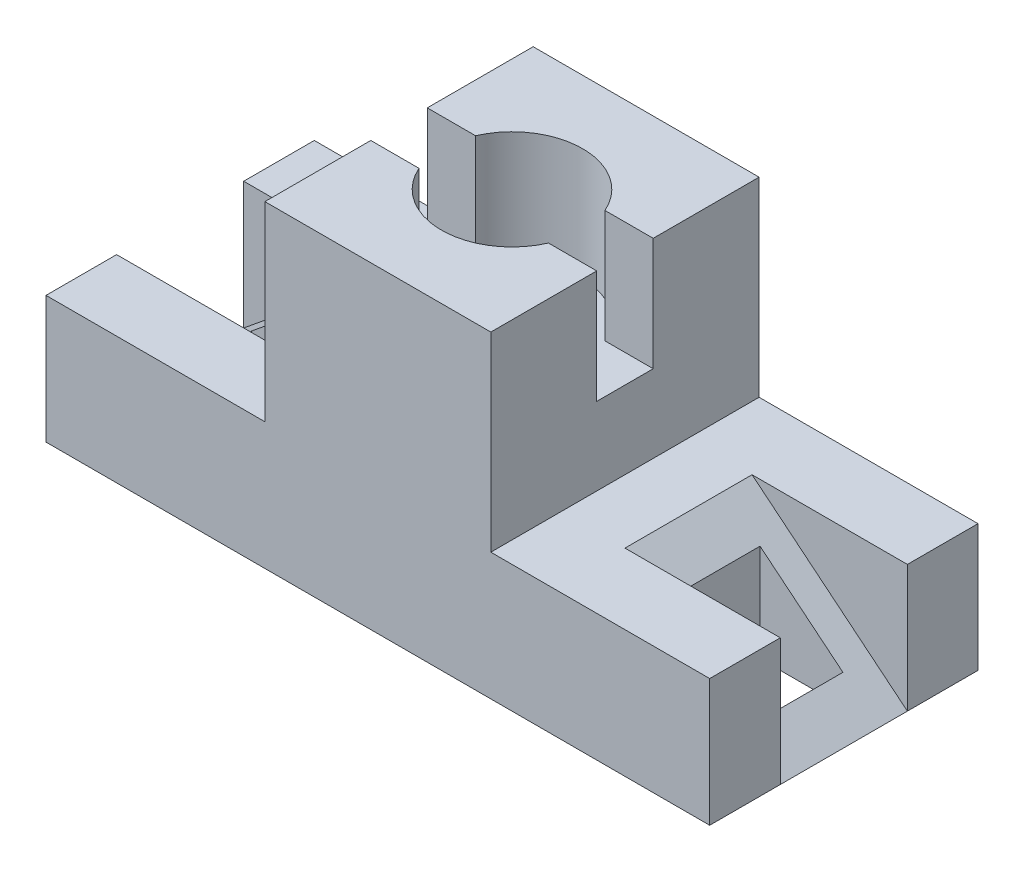
from build123d import *

# Parameters (mm, degrees)
BOSS_EXTRUDE1_DEPTH = 38
CUT_EXTRUDE1_DEPTH  = 16
SKETCH4_W           = 28.425340807
SKETCH4_H           = 18
CUT_EXTRUDE2_DEPTH  = 46
SKETCH5_W           = 11.74
SKETCH5_H           = 10
CUT_EXTRUDE3_DEPTH  = 76


with BuildPart() as part:
    # Sketch1 → Boss-Extrude1 (new body)
    with BuildSketch(Plane.XY):
        Polygon((0, 0), (0, 18), (31, 18), (31, 45), (63, 45), (63, 18), (94, 18), (94, 0), align=None)
    extrude(amount=BOSS_EXTRUDE1_DEPTH)

    # Sketch2 → Cut-Extrude1 (cut)
    with BuildSketch(Plane(origin=(0, 45, 0), x_dir=(1, 0, 0), z_dir=(0, 1, 0))):
        with BuildLine():
            Line((63, -23), (63, -15))
            Line((63, -15), (56.16515139, -15))
            ThreePointArc((56.16515139, -15), (47, -9), (37.83484861, -15))
            Line((37.83484861, -15), (31, -15))
            Line((31, -15), (31, -23))
            Line((31, -23), (37.83484861, -23))
            ThreePointArc((37.83484861, -23), (47, -29), (56.16515139, -23))
            Line((56.16515139, -23), (63, -23))
        make_face()
    extrude(amount=-CUT_EXTRUDE1_DEPTH, mode=Mode.SUBTRACT)

    # Sketch4 → Cut-Extrude2 (cut)
    with BuildSketch(Plane(origin=(0, 0, 0), x_dir=(-0.773957299203321, -0.6332377902572627, 0), z_dir=(0.6332377902572627, -0.773957299203321, 0))):
        with Locations((-14.212670404, -19)):
            Rectangle(SKETCH4_W, SKETCH4_H)
    cut_extrude2 = extrude(amount=-CUT_EXTRUDE2_DEPTH, mode=Mode.SUBTRACT)

    # Sketch5 → Cut-Extrude3 (cut)
    with BuildSketch(Plane(origin=(0, 18, 0), x_dir=(1, 0, 0), z_dir=(0, 1, 0))):
        with Locations((11, -19)):
            Rectangle(SKETCH5_W, SKETCH5_H)
    cut_extrude3 = extrude(amount=-CUT_EXTRUDE3_DEPTH, mode=Mode.SUBTRACT)

    # Mirror1: Cut-Extrude2, Cut-Extrude3 across plane
    add(cut_extrude2.mirror(Plane(origin=(47, 0, 0), x_dir=(0, 0, 1), z_dir=(1, 0, 0))), mode=Mode.SUBTRACT)
    add(cut_extrude3.mirror(Plane(origin=(47, 0, 0), x_dir=(0, 0, 1), z_dir=(1, 0, 0))), mode=Mode.SUBTRACT)


solid = part.part
